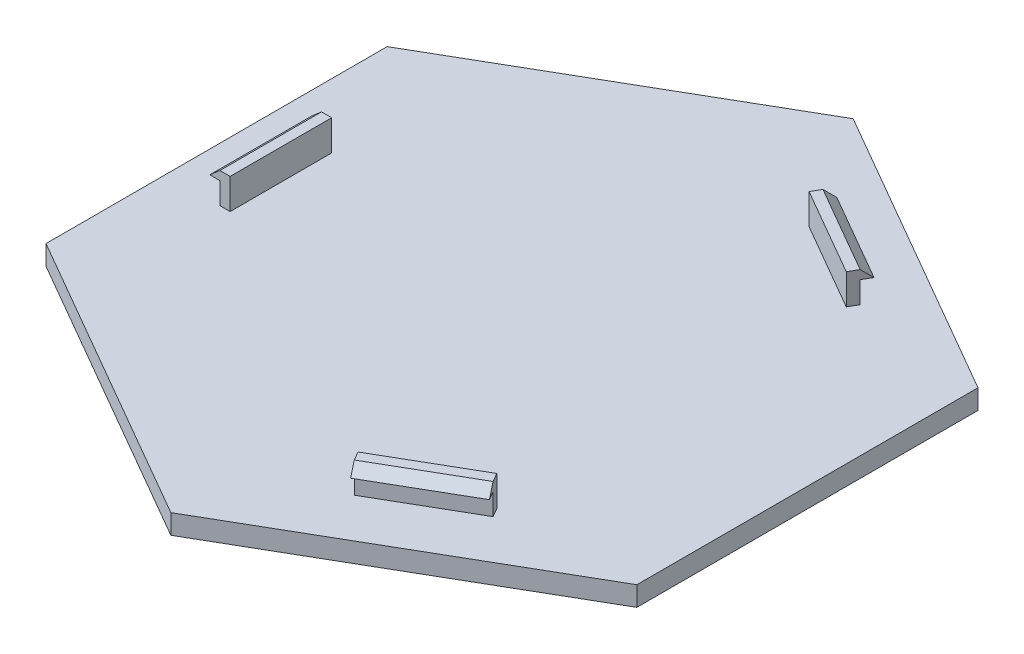
from build123d import *

# Parameters (mm, degrees)
RESSALTO_EXTRUS_O1_DEPTH  = 2.9
RESSALTO_EXTRUS_O8_DEPTH  = 4.5
ESBO_O11_W                = 15
ESBO_O11_H                = 1.3
RESSALTO_EXTRUS_O12_DEPTH = 1.5
ESBO_O15_W                = 15
ESBO_O15_H                = 1.3
RESSALTO_EXTRUS_O13_DEPTH = 1.5
ESBO_O16_W                = 15
ESBO_O16_H                = 1.3
RESSALTO_EXTRUS_O14_DEPTH = 1.5
CORTE_EXTRUS_O5_DEPTH     = 75.128633488
CORTE_EXTRUS_O8_DEPTH     = 75.128633488
CORTE_EXTRUS_O9_DEPTH     = 73.843490871


with BuildPart() as part:
    # Esboço1 → Ressalto-extrusão1 (new body)
    with BuildSketch(Plane(origin=(0, 0, 0), x_dir=(1, 0, 0), z_dir=(0, 1, 0))):
        Polygon((-43.62, 11.068078609), (-43.62, 25.184018742), (-12.224762753, 43.310067418), (0, 50.368037484), (31.395237247, 32.241988808), (43.62, 25.184018742), (43.62, -11.068078609), (43.62, -25.184018742), (12.224762753, -43.310067418), (0, -50.368037484), (-31.395237247, -32.241988808), (-43.62, -25.184018742), align=None)
    extrude(amount=RESSALTO_EXTRUS_O1_DEPTH)

    # Esboço4 → Ressalto-extrusão8 (add)
    with BuildSketch(Plane(origin=(0, 2.9, 0), x_dir=(1, 0, 0), z_dir=(0, 1, 0))):
        Polygon((-34.12, 0), (-34.12, 7.5), (-35.62, 7.5), (-35.62, -7.5), (-34.12, -7.5), align=None)
        Polygon((17.06, -29.548786777), (10.564809472, -33.298786777), (11.314809472, -34.597824883), (24.305190528, -27.097824883), (23.555190528, -25.798786777), align=None)
        Polygon((17.06, 29.548786777), (23.555190528, 25.798786777), (24.305190528, 27.097824883), (11.314809472, 34.597824883), (10.564809472, 33.298786777), align=None)
    extrude(amount=RESSALTO_EXTRUS_O8_DEPTH)

    # Esboço11 → Ressalto-extrusão12 (add)
    with BuildSketch(Plane.ZY.offset(35.62)):
        with Locations((0, 6.75)):
            Rectangle(ESBO_O11_W, ESBO_O11_H)
    extrude(amount=RESSALTO_EXTRUS_O12_DEPTH)

    # Esboço15 → Ressalto-extrusão13 (add)
    with BuildSketch(Plane(origin=(17.81, 0, 30.847824883), x_dir=(0.8660254037844386, 0, -0.5000000000000001), z_dir=(0.5000000000000001, 0, 0.8660254037844386))):
        with Locations((0, 6.75)):
            Rectangle(ESBO_O15_W, ESBO_O15_H)
    extrude(amount=RESSALTO_EXTRUS_O13_DEPTH)

    # Esboço16 → Ressalto-extrusão14 (add)
    with BuildSketch(Plane(origin=(17.81, 0, -30.847824883), x_dir=(-0.8660254037844386, 0, -0.5000000000000003), z_dir=(0.5000000000000003, 0, -0.8660254037844386))):
        with Locations((0, 6.75)):
            Rectangle(ESBO_O16_W, ESBO_O16_H)
    extrude(amount=RESSALTO_EXTRUS_O14_DEPTH)

    # Esboço17 → Corte-extrusão5 (cut, through all)
    with BuildSketch(Plane(origin=(-6.495190528, 0, 3.75), x_dir=(0.5000000000000064, 0, 0.866025403784435), z_dir=(-0.866025403784435, 0, 0.5000000000000064))):
        Polygon((35.62, 7.4), (37.12, 6.1), (38.522776478, 5.843708375), (38.659652416, 9.391906634), (36.37, 10.122640071), align=None)
    extrude(amount=-CORTE_EXTRUS_O5_DEPTH, mode=Mode.SUBTRACT)

    # Esboço18 → Corte-extrusão8 (cut, through all)
    with BuildSketch(Plane(origin=(6.495190528, 0, 3.75), x_dir=(0.5000000000000058, 0, -0.8660254037844354), z_dir=(0.8660254037844353, 0, 0.5000000000000057))):
        Polygon((35.62, 7.892314529), (37.556003767, 7.892314529), (38.139037221, 7.11493659), (37.685566756, 6.037944237), (37.12, 6.1), (35.62, 7.4), align=None)
    extrude(amount=-CORTE_EXTRUS_O8_DEPTH, mode=Mode.SUBTRACT)

    # Esboço19 → Corte-extrusão9 (cut, through all)
    with BuildSketch(Plane.XY.offset(7.5)):
        Polygon((-35.62, 8.416432615), (-35.62, 7.4), (-37.12, 6.1), (-37.526082167, 5.478521924), (-38.26778421, 5.863821686), (-38.576024021, 7.74215803), align=None)
    extrude(amount=-CORTE_EXTRUS_O9_DEPTH, mode=Mode.SUBTRACT)


solid = part.part
